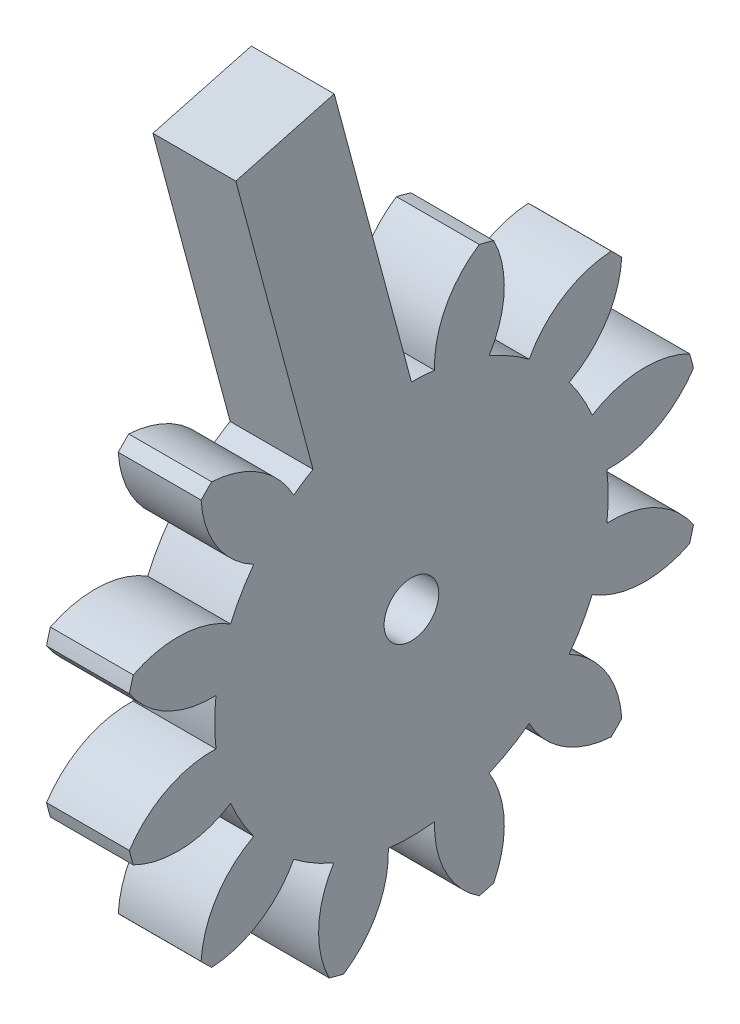
from build123d import *

# Parameters (mm, degrees)
BASPROSKE_W     = 5
BASPROSKE_H     = 17.5
TOOTHCUT_DEPTH  = 26.248762346
TEETHCUTS_COUNT = 12
TEETHCUTS_ANGLE = 330
BORSKE_R        = 4
BORE_DEPTH      = 50.0000508
EXTRUDE_1_DEPTH = 5
SKETCH_3_R      = 5.787483523
SKETCH_3_R_2    = 1.65
EXTRUDE_2_DEPTH = 5


with BuildPart() as part:
    # BasProSke → Base-Revolve (revolve)
    with BuildSketch(Plane(origin=(0, 0, 0), x_dir=(1, 0, 0), z_dir=(0, 1, 0)), mode=Mode.PRIVATE) as base_revolve_sk:
        with Locations((2.5, 8.75)):
            Rectangle(BASPROSKE_W, BASPROSKE_H)
    revolve(base_revolve_sk.sketch.rotate(Axis((-10, 0, 0), (1, 0, 0)), 180), axis=Axis((-10, 0, 0), (1, 0, 0)))

    # TooCutSke → ToothCut (cut, through all)
    with BuildSketch(Plane(origin=(0, 0, 0), x_dir=(0, 0, -1), z_dir=(1, 0, 0))):
        with BuildLine():
            ThreePointArc((1.394381134, 11.791843675), (0, 11.874), (-1.394381134, 11.791843675))
            ThreePointArc((-1.394381134, 11.791843675), (-2.068078374, 14.771857381), (-4.121860996, 17.033787221))
            ThreePointArc((-4.121860996, 17.033787221), (0, 17.5254), (4.121860996, 17.033787221))
            ThreePointArc((4.121860996, 17.033787221), (2.068078374, 14.771857381), (1.394381134, 11.791843675))
        make_face()
    toothcut = extrude(amount=TOOTHCUT_DEPTH, mode=Mode.SUBTRACT)

    # TeethCuts: ToothCut ×12 about axis
    teethcuts_axis = Axis((-10, 0, 0), (1, 0, 0))
    for i in range(1, TEETHCUTS_COUNT):
        add(toothcut.rotate(teethcuts_axis, i * TEETHCUTS_ANGLE / (TEETHCUTS_COUNT - 1)), mode=Mode.SUBTRACT)

    # BorSke → Bore (cut, symmetric)
    with BuildSketch(Plane(origin=(0, 0, 0), x_dir=(0, 0, -1), z_dir=(1, 0, 0))):
        with Locations(Location((0, 0, 0), (0, 0, 180))):
            Circle(BORSKE_R)
    extrude(amount=BORE_DEPTH, both=True, mode=Mode.SUBTRACT)

    # 草图2 → 凸台-拉伸1 (add)
    with BuildSketch(Plane(origin=(5, 0, 0), x_dir=(0, 0, -1), z_dir=(1, 0, 0))):
        Polygon((0, 11.874), (-5.937, 10.283185645), (-10.595742812, 27.669850518), (-4.658742812, 29.260664873), align=None)
    extrude(amount=-EXTRUDE_1_DEPTH)

    # 草图3 → 凸台-拉伸2 (add)
    with BuildSketch(Plane(origin=(5, 0, 0), x_dir=(0, 0, -1), z_dir=(1, 0, 0))):
        Circle(SKETCH_3_R)
        Circle(SKETCH_3_R_2, mode=Mode.SUBTRACT)
    extrude(amount=-EXTRUDE_2_DEPTH)


solid = part.part
